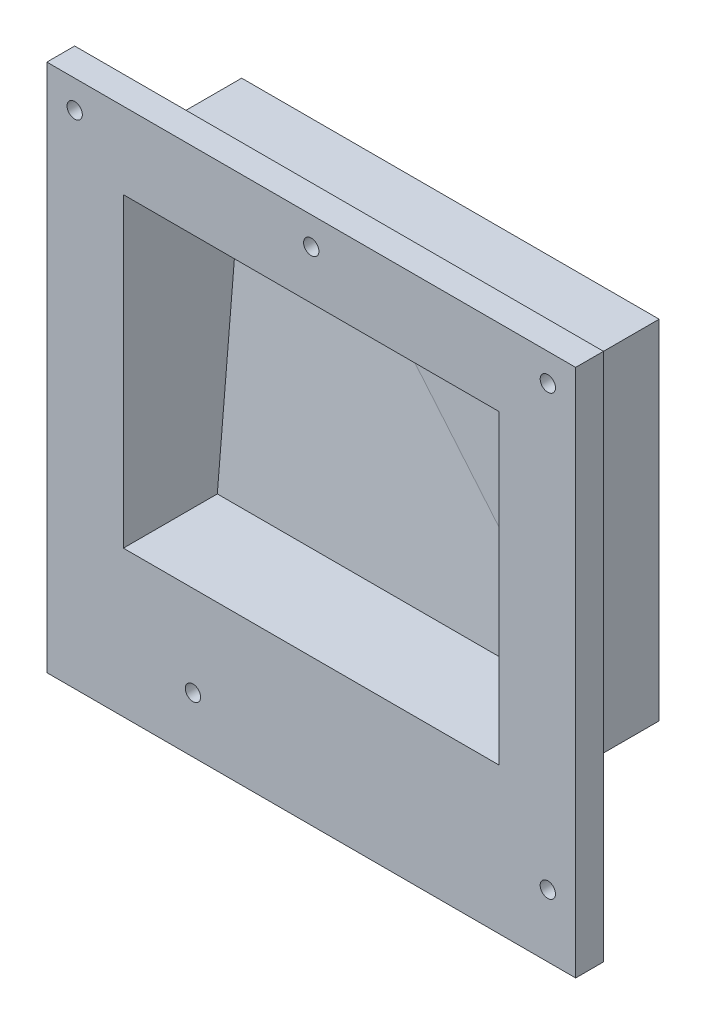
from build123d import *

# Parameters (mm, degrees)
SKETCH1_W           = 150
SKETCH1_H           = 45
BOSS_EXTRUDE1_DEPTH = 10
SKETCH2_W           = 150
SKETCH2_H           = 45
BOSS_EXTRUDE2_DEPTH = 10
SKETCH3_R           = 2.75
CUT_EXTRUDE1_DEPTH  = 30
CUT_EXTRUDE2_DEPTH  = 30
CUT_EXTRUDE3_DEPTH  = 47
SKETCH7_W           = 150
SKETCH7_H           = 125
SKETCH7_W_2         = 135
SKETCH7_H_2         = 110
BOSS_EXTRUDE3_DEPTH = 50
SKETCH8_W           = 135
SKETCH8_H           = 7.5
BOSS_EXTRUDE4_DEPTH = 110
CHAMFER2_SIZE       = 100
CHAMFER2_SIZE2      = 8.748866353


with BuildPart() as part:
    # Sketch1 → Boss-Extrude1 (new body)
    with BuildSketch(Plane.XY):
        Polygon((52.5, 45), (52.5, 170), (202.5, 170), (202.5, 45), (202.5, 0), (222.5, 0), (222.5, 190), (32.5, 190), (32.5, 45), (32.5, 0), (52.5, 0), align=None)
        with Locations((127.5, 22.5)):
            Rectangle(SKETCH1_W, SKETCH1_H)
    extrude(amount=BOSS_EXTRUDE1_DEPTH)

    # Sketch2 → Boss-Extrude2 (add)
    with BuildSketch(Plane(origin=(0, 0, 0), x_dir=(-1, 0, 0), z_dir=(0, 0, -1))):
        with Locations((-127.5, 22.5)):
            Rectangle(SKETCH2_W, SKETCH2_H)
    extrude(amount=BOSS_EXTRUDE2_DEPTH)

    # Sketch3 → Cut-Extrude1 (cut)
    with BuildSketch(Plane(origin=(0, 0, -10), x_dir=(-1, 0, 0), z_dir=(0, 0, -1))):
        with Locations((-85, 20)):
            Circle(SKETCH3_R)
    extrude(amount=-CUT_EXTRUDE1_DEPTH, mode=Mode.SUBTRACT)

    # Sketch4 → Cut-Extrude2 (cut)
    with BuildSketch(Plane.XY.offset(10)):
        with BuildLine():
            ThreePointArc((40.555456352, 181.944543648), (40.555456352, 178.055456352), (44.444543648, 178.055456352))
            Line((44.444543648, 178.055456352), (40.555456352, 181.944543648))
        make_face()
        with BuildLine():
            Line((40.555456352, 181.944543648), (44.444543648, 178.055456352))
            ThreePointArc((44.444543648, 178.055456352), (45.040668714, 178.947620561), (45.25, 180))
            ThreePointArc((45.25, 180), (43.552379439, 182.540668714), (40.555456352, 181.944543648))
        make_face()
        with BuildLine():
            ThreePointArc((130.25, 180), (129.444543648, 181.944543648), (127.5, 182.75))
            Line((127.5, 182.75), (127.5, 177.25))
            ThreePointArc((127.5, 177.25), (129.444543648, 178.055456352), (130.25, 180))
        make_face()
        with BuildLine():
            Line((127.5, 177.25), (127.5, 182.75))
            ThreePointArc((127.5, 182.75), (124.75, 180), (127.5, 177.25))
        make_face()
        with BuildLine():
            ThreePointArc((214.444543648, 181.944543648), (210.555456352, 181.944543648), (210.555456352, 178.055456352))
            Line((210.555456352, 178.055456352), (214.444543648, 181.944543648))
        make_face()
        with BuildLine():
            Line((214.444543648, 181.944543648), (210.555456352, 178.055456352))
            ThreePointArc((210.555456352, 178.055456352), (213.552379439, 177.459331286), (215.25, 180))
            ThreePointArc((215.25, 180), (215.040668714, 181.052379439), (214.444543648, 181.944543648))
        make_face()
    extrude(amount=-CUT_EXTRUDE2_DEPTH, mode=Mode.SUBTRACT)

    # Sketch5 → Cut-Extrude3 (cut)
    with BuildSketch(Plane.XY.offset(10)):
        with BuildLine():
            ThreePointArc((215.25, 22.5), (212.5, 25.25), (209.75, 22.5))
            Line((209.75, 22.5), (215.25, 22.5))
        make_face()
        with BuildLine():
            Line((215.25, 22.5), (209.75, 22.5))
            ThreePointArc((209.75, 22.5), (212.5, 19.75), (215.25, 22.5))
        make_face()
    extrude(amount=-CUT_EXTRUDE3_DEPTH, mode=Mode.SUBTRACT)

    # Sketch7 → Boss-Extrude3 (add)
    with BuildSketch(Plane.XY.offset(10)):
        with Locations((127.5, 107.5)):
            Rectangle(SKETCH7_W, SKETCH7_H)
        with Locations((127.5, 107.5)):
            Rectangle(SKETCH7_W_2, SKETCH7_H_2, mode=Mode.SUBTRACT)
    extrude(amount=-BOSS_EXTRUDE3_DEPTH)

    # Sketch8 → Boss-Extrude4 (add)
    with BuildSketch(Plane.XZ.offset(-162.5)):
        with Locations((127.5, -36.25)):
            Rectangle(SKETCH8_W, SKETCH8_H)
    extrude(amount=BOSS_EXTRUDE4_DEPTH)

    # Chamfer2
    chamfer2_edges = [part.edges().sort_by_distance(p)[0] for p in [
        (195, 107.5, -32.5),
        (127.5, 52.5, -32.5),
    ]]
    chamfer2_side = [part.faces().sort_by_distance(p)[0] for p in [
        (127.5, 107.5, -32.5),
    ]]
    chamfer(chamfer2_edges, length=CHAMFER2_SIZE, length2=CHAMFER2_SIZE2, reference=chamfer2_side[0])


solid = part.part
